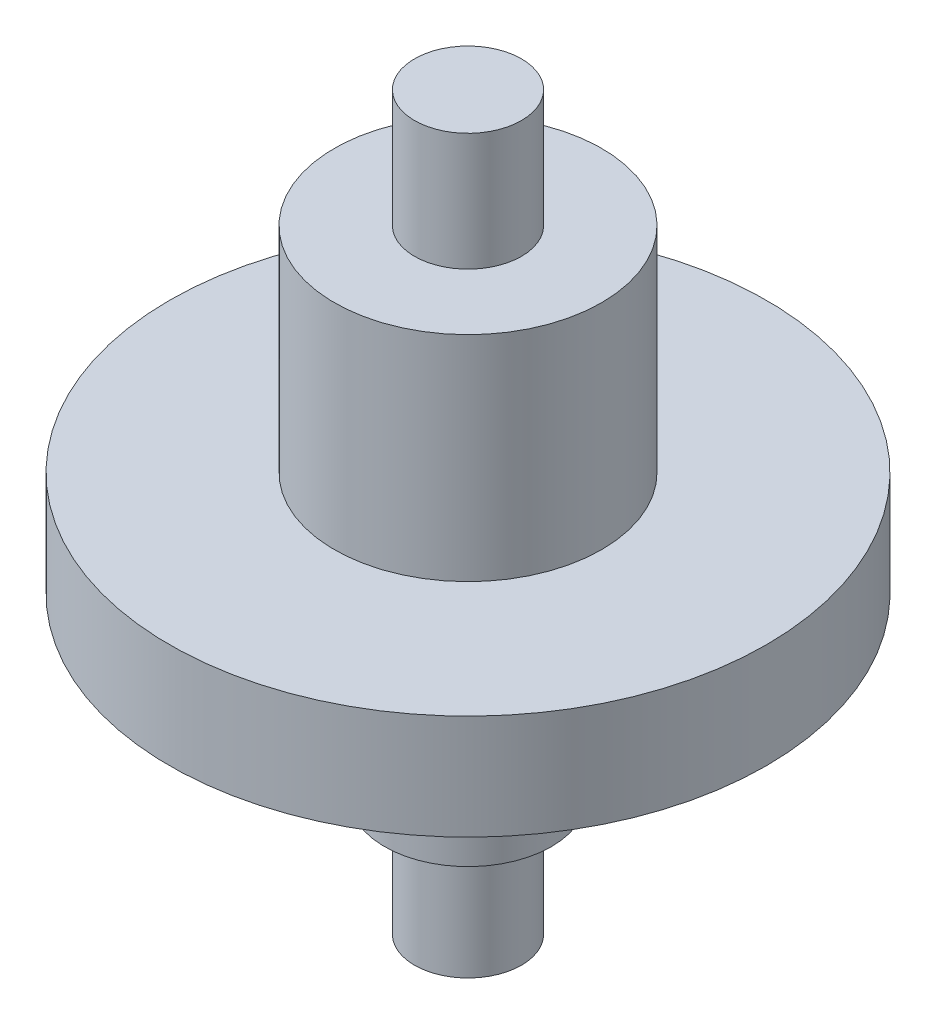
from build123d import *


with BuildPart() as part:
    # ｽｹｯﾁ1 → 回転1 (revolve)
    with BuildSketch(Plane.XY):
        Polygon((0, 0), (0, 17.1), (1.25, 17.1), (1.25, 14.35), (3.125, 14.35), (3.125, 9.35), (6.975, 9.35), (6.975, 6.9), (1.95, 6.9), (1.95, 2.75), (1.25, 2.75), (1.25, 0), align=None)
    revolve(axis=Axis((0, 0, 0), (0, 1, 0)))


solid = part.part
